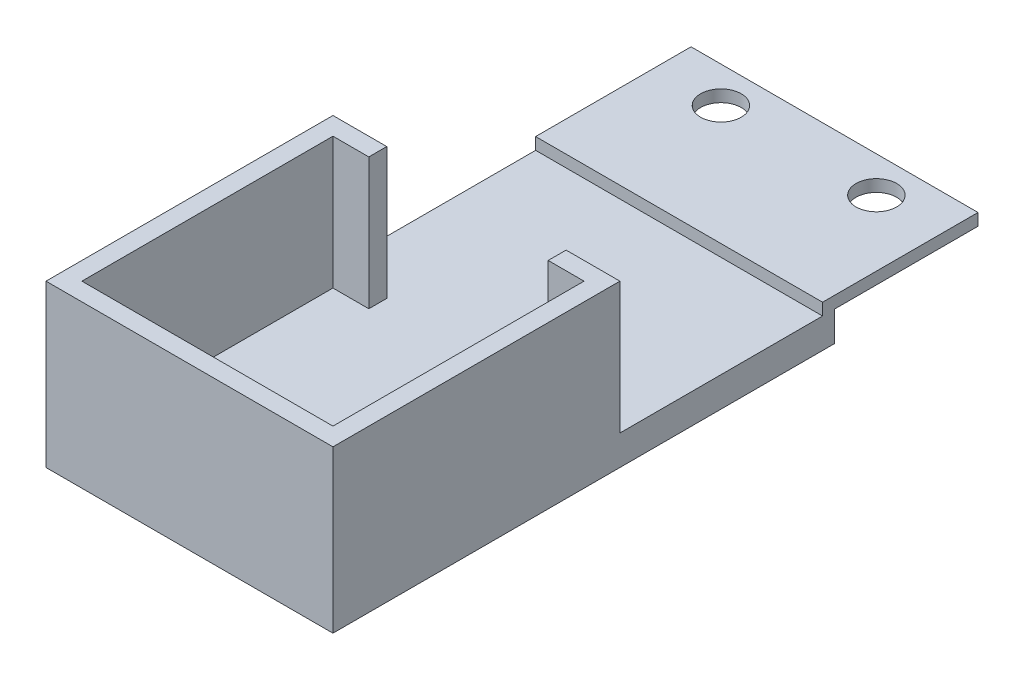
from build123d import *

# Parameters (mm, degrees)
BOSS_EXTRUDE1_DEPTH = 48
SKETCH4_W           = 48
SKETCH4_H           = 48
SKETCH4_W_2         = 42
SKETCH4_H_2         = 42
BOSS_EXTRUDE2_DEPTH = 25
SKETCH5_W           = 42
SKETCH5_H           = 42
BOSS_EXTRUDE3_DEPTH = 3
SKETCH7_R           = 3.4
CUT_EXTRUDE1_DEPTH  = 99.707699801
SKETCH8_W           = 30
SKETCH8_H           = 25
CUT_EXTRUDE3_DEPTH  = 10
BOSS_EXTRUDE4_DEPTH = 3


with BuildPart() as part:
    # Sketch3 → Boss-Extrude1 (new body)
    with BuildSketch(Plane(origin=(0, 0, 0), x_dir=(0, 0, -1), z_dir=(1, 0, 0))):
        Polygon((0, 0), (0, 5), (24, 5), (24, 7), (-2, 7), (-2, 2), (-83.9, 2), (-83.9, 0), align=None)
    extrude(amount=BOSS_EXTRUDE1_DEPTH)

    # Sketch4 → Boss-Extrude2 (add)
    with BuildSketch(Plane(origin=(0, 2, 0), x_dir=(1, 0, 0), z_dir=(0, 1, 0))):
        with Locations((24, -59.9)):
            Rectangle(SKETCH4_W, SKETCH4_H)
        with Locations((24, -59.9)):
            Rectangle(SKETCH4_W_2, SKETCH4_H_2, mode=Mode.SUBTRACT)
    extrude(amount=BOSS_EXTRUDE2_DEPTH)

    # Sketch5 → Boss-Extrude3 (add)
    with BuildSketch(Plane(origin=(0, 2, 0), x_dir=(1, 0, 0), z_dir=(0, 1, 0))):
        with Locations((24, -59.9)):
            Rectangle(SKETCH5_W, SKETCH5_H)
    extrude(amount=BOSS_EXTRUDE3_DEPTH)

    # Sketch7 → Cut-Extrude1 (cut, through all)
    with BuildSketch(Plane(origin=(0, 7, 0), x_dir=(1, 0, 0), z_dir=(0, 1, 0))):
        with Locations(Location((11, 18, 0), (0, 0, 270))):
            Circle(SKETCH7_R)
        with Locations(Location((37, 18, 0), (0, 0, 270))):
            Circle(SKETCH7_R)
    extrude(amount=-CUT_EXTRUDE1_DEPTH, mode=Mode.SUBTRACT)

    # Sketch8 → Cut-Extrude3 (cut)
    with BuildSketch(Plane(origin=(0, 0, 35.9), x_dir=(-1, 0, 0), z_dir=(0, 0, -1))):
        with Locations((-24, 14.5)):
            Rectangle(SKETCH8_W, SKETCH8_H)
    extrude(amount=-CUT_EXTRUDE3_DEPTH, mode=Mode.SUBTRACT)

    # Sketch9 → Boss-Extrude4 (add)
    with BuildSketch(Plane(origin=(0, 2, 0), x_dir=(1, 0, 0), z_dir=(0, 1, 0))):
        Polygon((0, -2), (0, -35.9), (9, -35.9), (9, -45.9), (39, -45.9), (39, -35.9), (48, -35.9), (48, -2), align=None)
    extrude(amount=BOSS_EXTRUDE4_DEPTH)


solid = part.part
